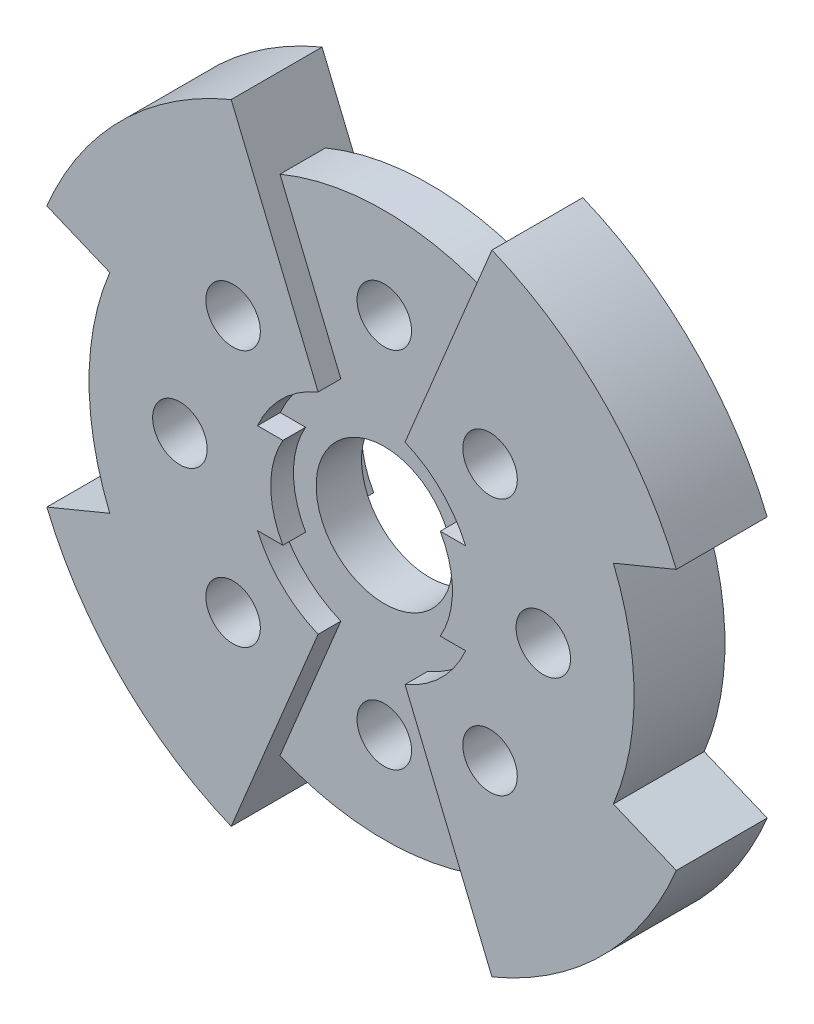
from build123d import *

# Parameters (mm, degrees)
SKETCH1_R             = 6
BOSS_EXTRUDE1_DEPTH   = 10
BOSS_EXTRUDE1_2_DEPTH = 10
SKETCH1_3_R           = 6
SKETCH1_3_R_2         = 15
BOSS_EXTRUDE2_DEPTH   = 5


with BuildPart() as part:
    # Sketch1 → Boss-Extrude1 (new, symmetric)
    with BuildSketch(Plane.XY):
        with BuildLine():
            Line((28.701257427, 69.290964938), (9.567085809, 23.096988313))
            ThreePointArc((9.567085809, 23.096988313), (17.510562404, 17.843211715), (22.912878475, 10))
            Line((22.912878475, 10), (17.320508076, 10))
            ThreePointArc((17.320508076, 10), (20, 0), (17.320508076, -10))
            Line((17.320508076, -10), (22.912878475, -10))
            ThreePointArc((22.912878475, -10), (17.510562404, -17.843211715), (9.567085809, -23.096988313))
            Line((9.567085809, -23.096988313), (28.701257427, -69.290964938))
            ThreePointArc((28.701257427, -69.290964938), (53.033008589, -53.033008589), (69.290964938, -28.701257427))
            Line((69.290964938, -28.701257427), (55.432771951, -22.961005942))
            ThreePointArc((55.432771951, -22.961005942), (60, 0), (55.432771951, 22.961005942))
            Line((55.432771951, 22.961005942), (69.290964938, 28.701257427))
            ThreePointArc((69.290964938, 28.701257427), (53.033008589, 53.033008589), (28.701257427, 69.290964938))
        make_face()
        with Locations((28.284271247, -28.284271247)):
            Circle(SKETCH1_R, mode=Mode.SUBTRACT)
        with Locations((40, 0)):
            Circle(SKETCH1_R, mode=Mode.SUBTRACT)
        with Locations((28.284271247, 28.284271247)):
            Circle(SKETCH1_R, mode=Mode.SUBTRACT)
    extrude(amount=BOSS_EXTRUDE1_DEPTH, both=True)



with BuildPart() as body_2:
    # Sketch1 → Boss-Extrude1 2 (new, symmetric)
    with BuildSketch(Plane.XY):
        with BuildLine():
            Line((-9.567085809, 23.096988313), (-28.701257427, 69.290964938))
            ThreePointArc((-28.701257427, 69.290964938), (-53.033008589, 53.033008589), (-69.290964938, 28.701257427))
            Line((-69.290964938, 28.701257427), (-55.432771951, 22.961005942))
            ThreePointArc((-55.432771951, 22.961005942), (-60, 0), (-55.432771951, -22.961005942))
            Line((-55.432771951, -22.961005942), (-69.290964938, -28.701257427))
            ThreePointArc((-69.290964938, -28.701257427), (-53.033008589, -53.033008589), (-28.701257427, -69.290964938))
            Line((-28.701257427, -69.290964938), (-9.567085809, -23.096988313))
            ThreePointArc((-9.567085809, -23.096988313), (-17.510562404, -17.843211715), (-22.912878475, -10))
            Line((-22.912878475, -10), (-17.320508076, -10))
            ThreePointArc((-17.320508076, -10), (-20, 0), (-17.320508076, 10))
            Line((-17.320508076, 10), (-22.912878475, 10))
            ThreePointArc((-22.912878475, 10), (-17.510562404, 17.843211715), (-9.567085809, 23.096988313))
        make_face()
        with Locations((-28.284271247, -28.284271247)):
            Circle(SKETCH1_R, mode=Mode.SUBTRACT)
        with Locations((-40, 0)):
            Circle(SKETCH1_R, mode=Mode.SUBTRACT)
        with Locations((-28.284271247, 28.284271247)):
            Circle(SKETCH1_R, mode=Mode.SUBTRACT)
    extrude(amount=BOSS_EXTRUDE1_2_DEPTH, both=True)


with BuildPart() as part_1:
    add(part.part)

    add(body_2.part)  # Boss-Extrude2 merges body 2
    # Sketch1<3> → Boss-Extrude2 (add, symmetric)
    with BuildSketch(Plane.XY):
        with BuildLine():
            ThreePointArc((22.912878475, 10), (17.510562404, 17.843211715), (9.567085809, 23.096988313))
            Line((9.567085809, 23.096988313), (22.961005942, 55.432771951))
            ThreePointArc((22.961005942, 55.432771951), (0, 60), (-22.961005942, 55.432771951))
            Line((-22.961005942, 55.432771951), (-9.567085809, 23.096988313))
            ThreePointArc((-9.567085809, 23.096988313), (-17.510562404, 17.843211715), (-22.912878475, 10))
            Line((-22.912878475, 10), (-17.320508076, 10))
            ThreePointArc((-17.320508076, 10), (-20, 0), (-17.320508076, -10))
            Line((-17.320508076, -10), (-22.912878475, -10))
            ThreePointArc((-22.912878475, -10), (-17.510562404, -17.843211715), (-9.567085809, -23.096988313))
            Line((-9.567085809, -23.096988313), (-22.961005942, -55.432771951))
            ThreePointArc((-22.961005942, -55.432771951), (0, -60), (22.961005942, -55.432771951))
            Line((22.961005942, -55.432771951), (9.567085809, -23.096988313))
            ThreePointArc((9.567085809, -23.096988313), (17.510562404, -17.843211715), (22.912878475, -10))
            Line((22.912878475, -10), (17.320508076, -10))
            ThreePointArc((17.320508076, -10), (20, 0), (17.320508076, 10))
            Line((17.320508076, 10), (22.912878475, 10))
        make_face()
        with Locations((0, -40)):
            Circle(SKETCH1_3_R, mode=Mode.SUBTRACT)
        Circle(SKETCH1_3_R_2, mode=Mode.SUBTRACT)
        with Locations((0, 40)):
            Circle(SKETCH1_3_R, mode=Mode.SUBTRACT)
    extrude(amount=BOSS_EXTRUDE2_DEPTH, both=True)


solid = part_1.part
